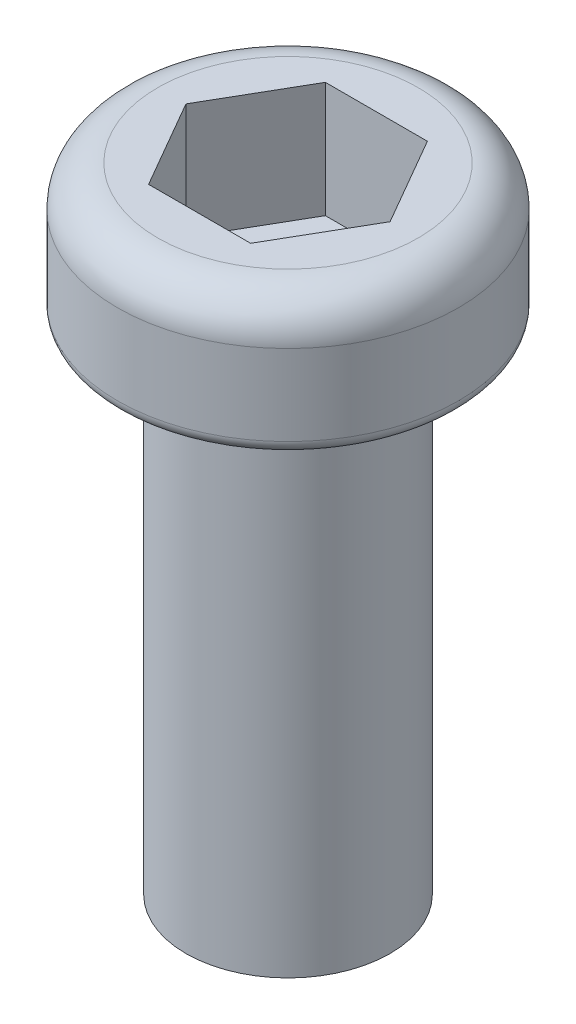
from build123d import *

# Parameters (mm, degrees)
SKETCH1_R           = 3.175
BOSS_EXTRUDE3_DEPTH = 2.5
CUT_EXTRUDE3_DEPTH  = 2.15
SKETCH8_R           = 1.9
BOSS_EXTRUDE4_DEPTH = 9.3
FILLET2_R           = 0.75
FILLET3_R           = 0.25


with BuildPart() as part:
    # Sketch1 → Boss-Extrude3 (new body)
    with BuildSketch(Plane(origin=(0, 0, 0), x_dir=(1, 0, 0), z_dir=(0, 1, 0))):
        with Locations(Location((0, 0, 0), (0, 0, 270))):
            Circle(SKETCH1_R)
    extrude(amount=BOSS_EXTRUDE3_DEPTH)

    # Sketch7 → Cut-Extrude3 (cut)
    with BuildSketch(Plane(origin=(0, 2.5, 0), x_dir=(1, 0, 0), z_dir=(0, 1, 0))):
        Polygon((0.95, 1.645448267), (-0.95, 1.645448267), (-1.9, 0), (-0.95, -1.645448267), (0.95, -1.645448267), (1.9, 0), align=None)
    extrude(amount=-CUT_EXTRUDE3_DEPTH, mode=Mode.SUBTRACT)

    # Sketch8 → Boss-Extrude4 (add)
    with BuildSketch(Plane(origin=(0, 0, 0), x_dir=(1, 0, 0), z_dir=(0, 1, 0))):
        with Locations(Location((0, 0, 0), (0, 0, 270))):
            Circle(SKETCH8_R)
    extrude(amount=-BOSS_EXTRUDE4_DEPTH)

    # Fillet2
    fillet2_edges = [part.edges().sort_by_distance(p)[0] for p in [
        (0, 2.5, -3.175),
    ]]
    fillet(fillet2_edges, radius=FILLET2_R)

    # Fillet3
    fillet3_edges = [part.edges().sort_by_distance(p)[0] for p in [
        (0, 0, -3.175),
    ]]
    fillet(fillet3_edges, radius=FILLET3_R)


solid = part.part
